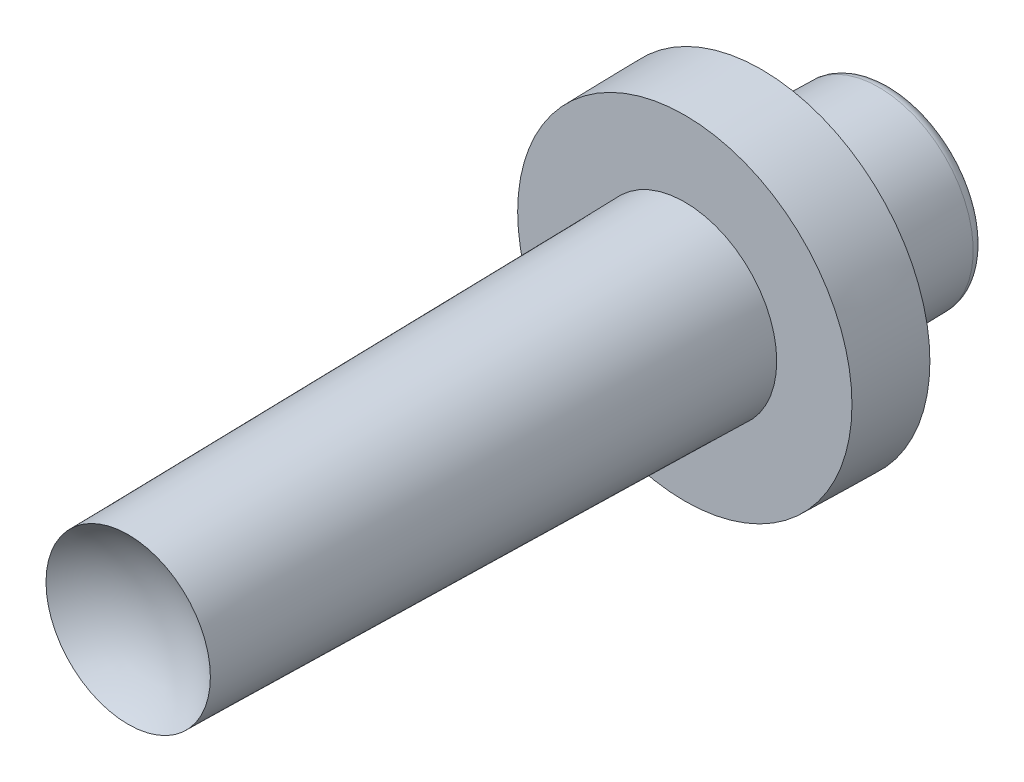
from build123d import *

# Parameters (mm, degrees)
SKETCH1_R           = 2.794
BOSS_EXTRUDE1_DEPTH = 1.27
BOSS_EXTRUDE1_TAPER = 1
SKETCH2_R           = 1.524
BOSS_EXTRUDE2_DEPTH = 9.23000005
BOSS_EXTRUDE2_TAPER = 1
SKETCH3_R           = 1.6
BOSS_EXTRUDE3_DEPTH = 2.1
BOSS_EXTRUDE3_TAPER = 1
FILLET1_R           = 0.2


with BuildPart() as part:
    # Sketch1 → Boss-Extrude1 (new body)
    with BuildSketch(Plane.XY):
        Circle(SKETCH1_R)
    extrude(amount=BOSS_EXTRUDE1_DEPTH, taper=BOSS_EXTRUDE1_TAPER)

    # Sketch2 → Boss-Extrude2 (add)
    with BuildSketch(Plane.XY.offset(1.27)):
        Circle(SKETCH2_R)
    extrude(amount=BOSS_EXTRUDE2_DEPTH, taper=BOSS_EXTRUDE2_TAPER)

    # Sketch3 → Boss-Extrude3 (add)
    with BuildSketch(Plane(origin=(0, 0, 0), x_dir=(-1, 0, 0), z_dir=(0, 0, -1))):
        Circle(SKETCH3_R)
    extrude(amount=BOSS_EXTRUDE3_DEPTH, taper=BOSS_EXTRUDE3_TAPER)

    # Sketch5 → Cut-Revolve4 (revolve, cut)
    with BuildSketch(Plane(origin=(0, 0, 0), x_dir=(1, 0, 0), z_dir=(0, 1, 0))):
        with BuildLine():
            Line((0, -10.50000005), (0, -9.94120005))
            ThreePointArc((0, -9.94120005), (0.736499476, -10.086324189), (1.36288975, -10.50000005))
            Line((1.36288975, -10.50000005), (1.36288975, -10.823922581))
            Line((1.36288975, -10.823922581), (0, -10.823922581))
            Line((0, -10.823922581), (0, -10.50000005))
        make_face()
    revolve(axis=Axis((0, 0, 1.27), (0, 0, 1)), mode=Mode.SUBTRACT)

    # Sketch6 → Revolve1 (revolve)
    with BuildSketch(Plane(origin=(0, 0, 0), x_dir=(1, 0, 0), z_dir=(0, 1, 0))):
        with BuildLine():
            Line((0, 2.3), (0, 2.1))
            Line((0, 2.1), (-1.563344364, 2.1))
            ThreePointArc((-1.563344364, 2.1), (-0.788042765, 2.249797078), (0, 2.3))
        make_face()
    revolve(axis=Axis((0, 0, -2.1), (0, 0, -1)))

    # Fillet1
    fillet1_edges = [part.edges().sort_by_distance(p)[0] for p in [
        (1.563344364, 0, -2.1),
    ]]
    fillet(fillet1_edges, radius=FILLET1_R)


solid = part.part
